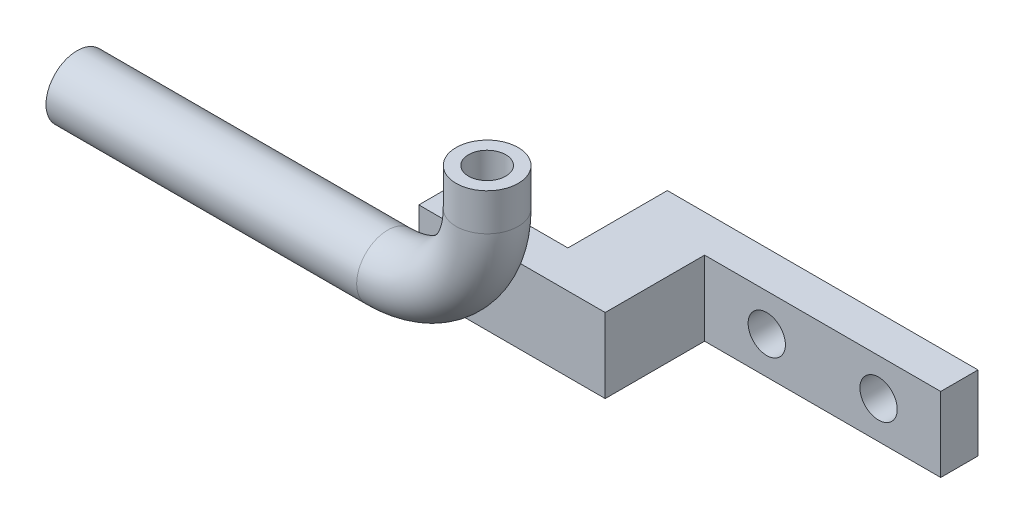
from build123d import *

# Parameters (mm, degrees)
SKETCH3_R           = 2.5
SKETCH3_R_2         = 1.5
SKETCH4_W           = 15
SKETCH4_H           = 6
BOSS_EXTRUDE1_DEPTH = 3
SKETCH5_W           = 6
SKETCH5_H           = 6
BOSS_EXTRUDE2_DEPTH = 11
SKETCH6_W           = 25
SKETCH6_H           = 6
BOSS_EXTRUDE3_DEPTH = 3
SKETCH7_R           = 1.5
CUT_EXTRUDE1_DEPTH  = 75.707087809


with BuildPart() as part:
    # Sweep1: sweep along a path in Sketch1
    with BuildLine(Plane.XY) as sweep1_path:
        Line((-60.701435552, 30.563020681), (-35.701435552, 30.563020681))
        ThreePointArc((-35.701435552, 30.563020681), (-30.044581303, 32.906166431), (-27.701435552, 38.563020681))
        Line((-27.701435552, 38.563020681), (-27.701435552, 41.563020681))
    # Sketch3 → Sweep1 (sweep)
    with BuildSketch(Plane(origin=(0, 41.563020681, 0), x_dir=(-1, 0, 0), z_dir=(0, 1, 0))):
        with Locations((27.701435552, 0)):
            Circle(SKETCH3_R)
        with Locations((27.701435552, 0)):
            Circle(SKETCH3_R_2, mode=Mode.SUBTRACT)
    sweep(path=sweep1_path.line)


with BuildPart() as body_2:
    # Sketch4 → Boss-Extrude1 (new body)
    with BuildSketch(Plane(origin=(0, 0, -2.5), x_dir=(-1, 0, 0), z_dir=(0, 0, -1))):
        with Locations((28.201435552, 30.563020681)):
            Rectangle(SKETCH4_W, SKETCH4_H)
    extrude(amount=BOSS_EXTRUDE1_DEPTH)

    # Sketch5 → Boss-Extrude2 (add)
    with BuildSketch(Plane.XY.offset(-2.5)):
        with Locations((-23.701435552, 30.563020681)):
            Rectangle(SKETCH5_W, SKETCH5_H)
    extrude(amount=-BOSS_EXTRUDE2_DEPTH)

    # Sketch6 → Boss-Extrude3 (add)
    with BuildSketch(Plane(origin=(0, 0, -13.5), x_dir=(-1, 0, 0), z_dir=(0, 0, -1))):
        with Locations((14.201435552, 30.563020681)):
            Rectangle(SKETCH6_W, SKETCH6_H)
    extrude(amount=-BOSS_EXTRUDE3_DEPTH)

    # Sketch7 → Cut-Extrude1 (cut, through all)
    with BuildSketch(Plane.XY.offset(-10.5)):
        with Locations((-15.701435552, 30.563020681)):
            Circle(SKETCH7_R)
        with Locations((-6.701435552, 30.563020681)):
            Circle(SKETCH7_R)
    extrude(amount=-CUT_EXTRUDE1_DEPTH, mode=Mode.SUBTRACT)


solid = Compound([part.part, body_2.part])
